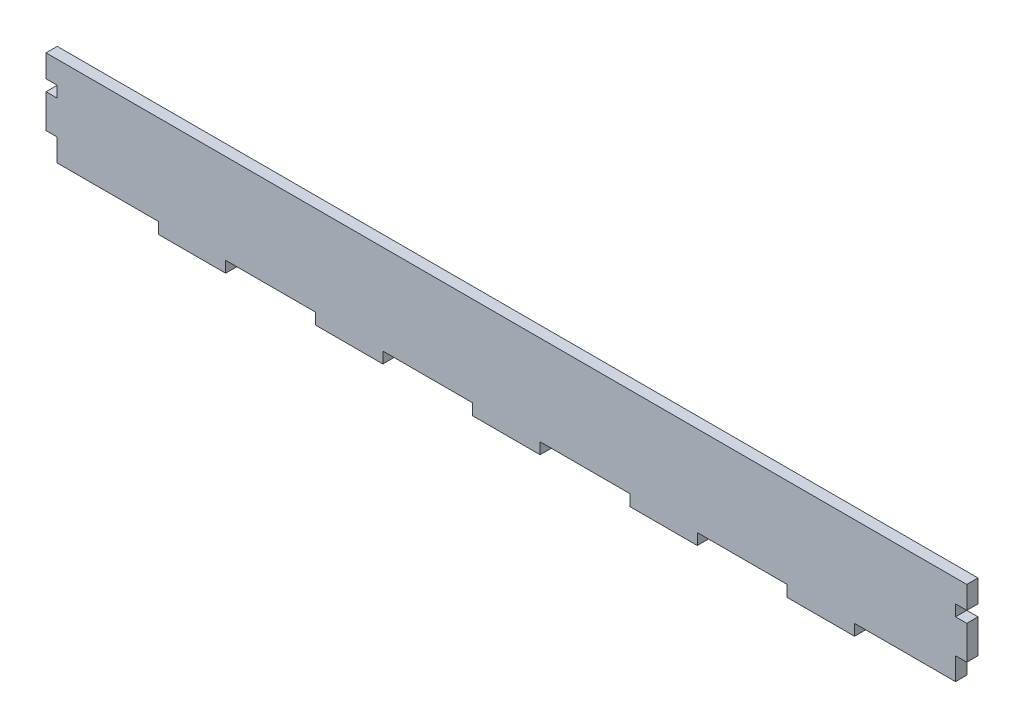
from build123d import *

# Parameters (mm, degrees)
BOSS_EXTRUDE1_DEPTH = 5


with BuildPart() as part:
    # Sketch1 → Boss-Extrude1 (new body)
    with BuildSketch(Plane.XY):
        Polygon((-425, -420), (-425, -430), (-380, -430), (-380, -435), (-350, -435), (-350, -430), (-310, -430), (-310, -435), (-280, -435), (-280, -430), (-240, -430), (-240, -435), (-210, -435), (-210, -430), (-170, -430), (-170, -435), (-140, -435), (-140, -430), (-100, -430), (-100, -435), (-70, -435), (-70, -430), (-25, -430), (-25, -420), (-20, -420), (-20, -405), (-25, -405), (-25, -400), (-20, -400), (-20, -390), (-430, -390), (-430, -400), (-425, -400), (-425, -405), (-430, -405), (-430, -420), align=None)
    extrude(amount=BOSS_EXTRUDE1_DEPTH)


solid = part.part
